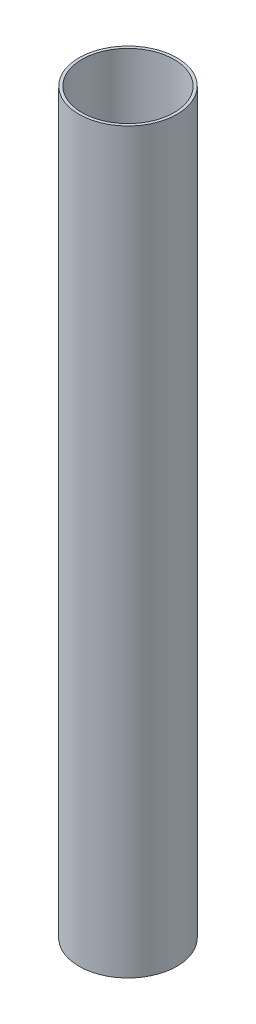
from build123d import *

# Parameters (mm, degrees)
SKETCH1_R           = 53.975
SKETCH1_R_2         = 50.8
BOSS_EXTRUDE1_DEPTH = 406.4


with BuildPart() as part:
    # Sketch1 → Boss-Extrude1 (new, symmetric)
    with BuildSketch(Plane(origin=(0, 0, 0), x_dir=(1, 0, 0), z_dir=(0, 1, 0))):
        with Locations(Location((0, 0, 0), (0, 0, 270))):
            Circle(SKETCH1_R)
        with Locations(Location((0, 0, 0), (0, 0, 270))):
            Circle(SKETCH1_R_2, mode=Mode.SUBTRACT)
    extrude(amount=BOSS_EXTRUDE1_DEPTH, both=True)


solid = part.part
